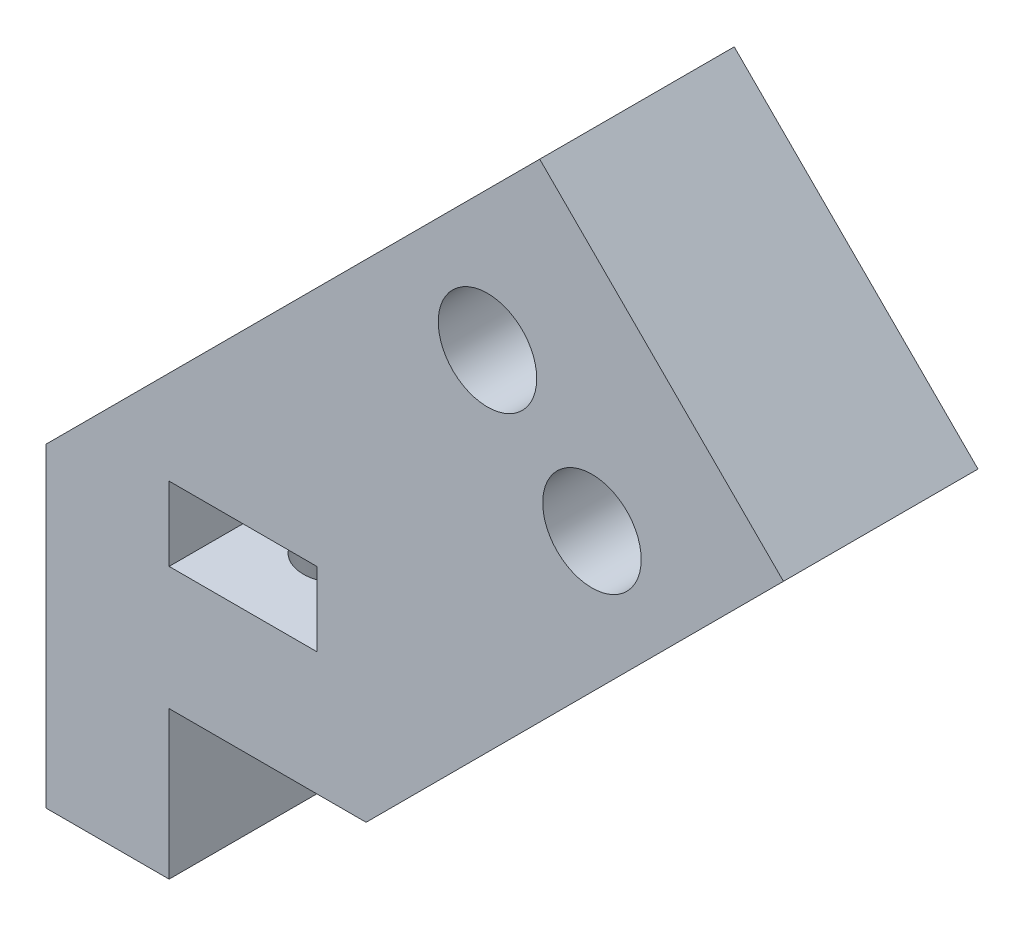
from build123d import *

# Parameters (mm, degrees)
SKETCH1_R           = 2
BOSS_EXTRUDE1_DEPTH = 7.9
SKETCH2_R           = 1.5
CUT_EXTRUDE1_DEPTH  = 45.813969002
SKETCH3_W           = 6
SKETCH3_H           = 3
CUT_EXTRUDE2_DEPTH  = 49.646507856


with BuildPart() as part:
    # Sketch1 → Boss-Extrude1 (new body)
    with BuildSketch(Plane.XY):
        Polygon((-30, 0), (-30, 6), (-22, 6), (-5.050252532, 22.949747468), (-14.949747468, 32.849242405), (-35, 12.798989873), (-35, 0), align=None)
        with Locations((-12.828427125, 20.828427125)):
            Circle(SKETCH1_R, mode=Mode.SUBTRACT)
        with Locations((-17.071067812, 25.071067812)):
            Circle(SKETCH1_R, mode=Mode.SUBTRACT)
    extrude(amount=-BOSS_EXTRUDE1_DEPTH)

    # Sketch2 → Cut-Extrude1 (cut, through all)
    with BuildSketch(Plane.XZ.offset(-6)):
        with Locations(Location((-27, -3.95, 0), (0, 0, 270))):
            Circle(SKETCH2_R)
    extrude(amount=-CUT_EXTRUDE1_DEPTH, mode=Mode.SUBTRACT)

    # Sketch3 → Cut-Extrude2 (cut, through all)
    with BuildSketch(Plane.XY):
        with Locations((-27, 12.5)):
            Rectangle(SKETCH3_W, SKETCH3_H)
    extrude(amount=-CUT_EXTRUDE2_DEPTH, mode=Mode.SUBTRACT)


solid = part.part
